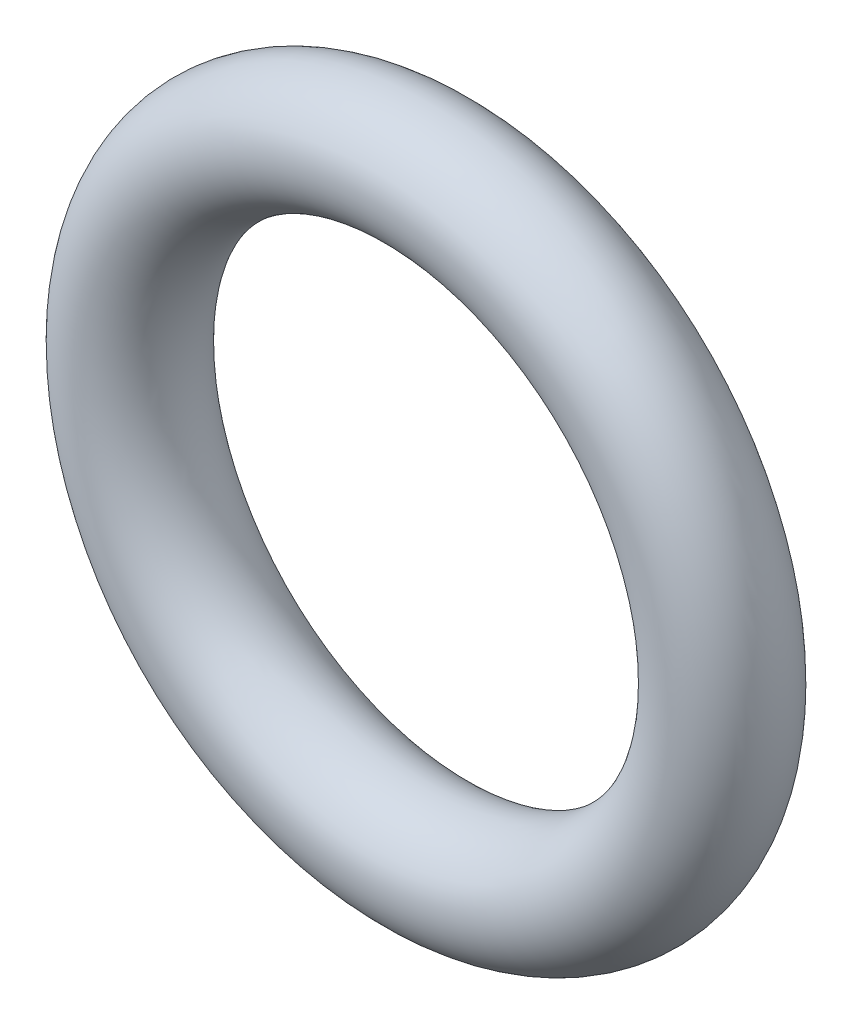
from build123d import *

# Parameters (mm, degrees)
SKETCH1_R = 0.25


with BuildPart() as part:
    # Sketch1 → Revolve1 (revolve)
    with BuildSketch(Plane(origin=(0, 0, 0), x_dir=(1, 0, 0), z_dir=(0, 1, 0))):
        with Locations((-1.25, 0)):
            Circle(SKETCH1_R)
    revolve(axis=Axis((0, 0, -75.924687965), (0, 0, 1)))


solid = part.part
